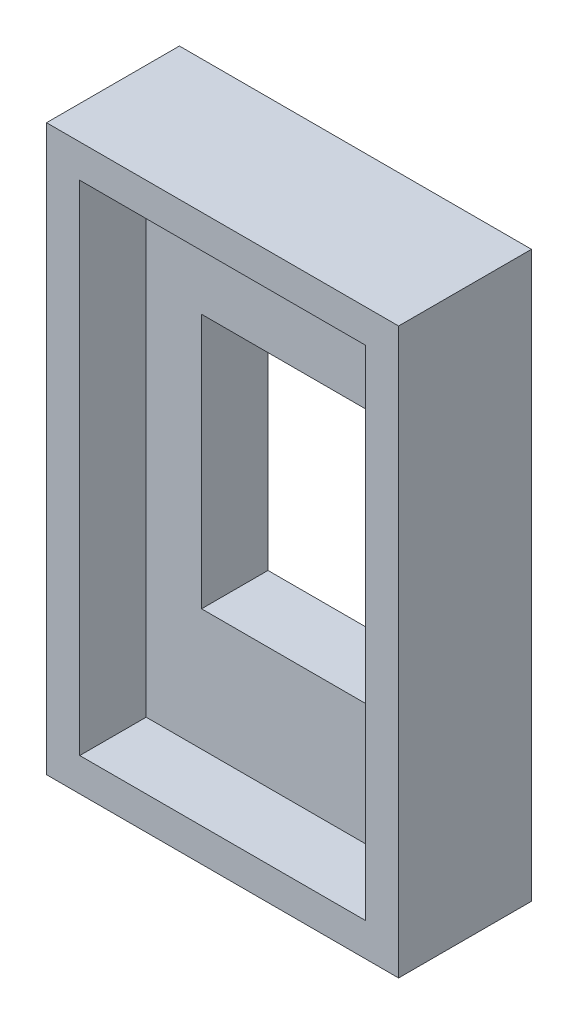
from build123d import *

# Parameters (mm, degrees)
SKETCH3_W           = 53
SKETCH3_H           = 85
BOSS_EXTRUDE1_DEPTH = 20
SKETCH4_W           = 43
SKETCH4_H           = 75
CUT_EXTRUDE1_DEPTH  = 10
SKETCH5_W           = 26.321433762
SKETCH5_H           = 38.399655618
CUT_EXTRUDE2_DEPTH  = 10


with BuildPart() as part:
    # Sketch3 → Boss-Extrude1 (new body)
    with BuildSketch(Plane.XY):
        Rectangle(SKETCH3_W, SKETCH3_H)
    extrude(amount=BOSS_EXTRUDE1_DEPTH)

    # Sketch4 → Cut-Extrude1 (cut)
    with BuildSketch(Plane.XY.offset(20)):
        Rectangle(SKETCH4_W, SKETCH4_H)
    extrude(amount=-CUT_EXTRUDE1_DEPTH, mode=Mode.SUBTRACT)

    # Sketch5 → Cut-Extrude2 (cut)
    with BuildSketch(Plane(origin=(0, 0, 0), x_dir=(-1, 0, 0), z_dir=(0, 0, -1))):
        Rectangle(SKETCH5_W, SKETCH5_H)
    extrude(amount=-CUT_EXTRUDE2_DEPTH, mode=Mode.SUBTRACT)


solid = part.part
